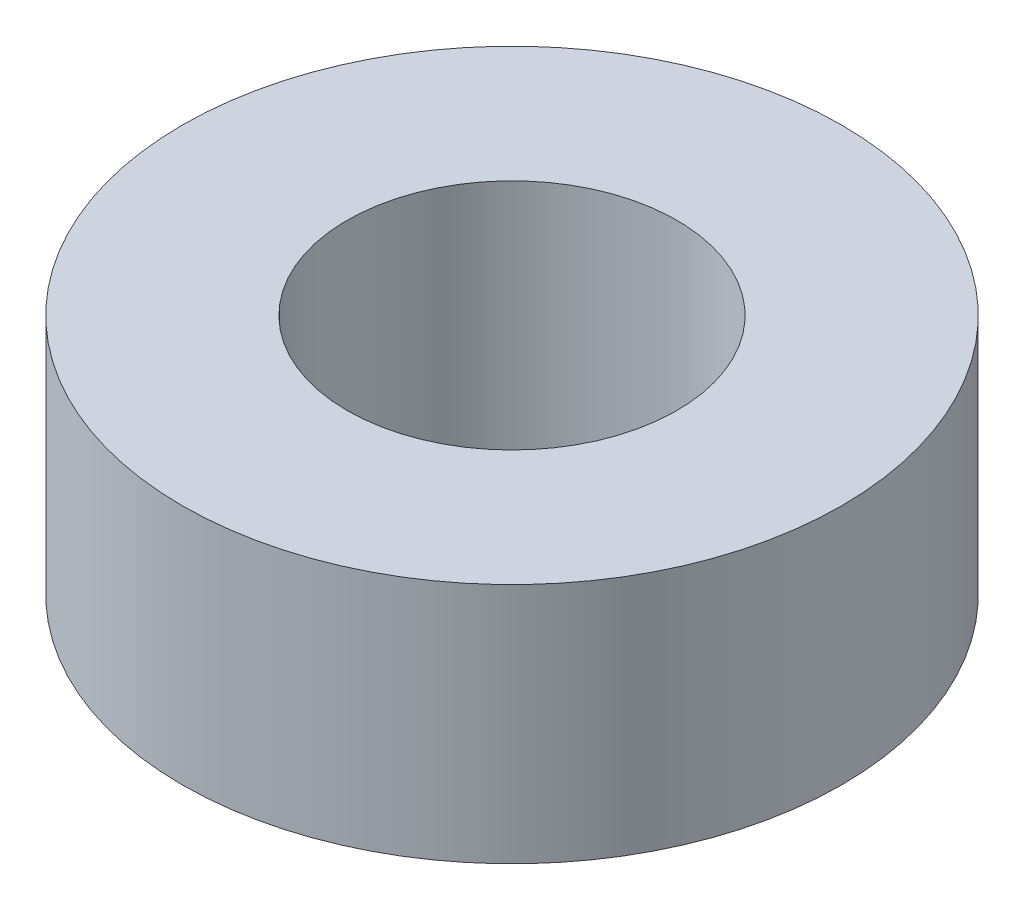
from build123d import *

# Parameters (mm, degrees)
SKETCH1_R           = 150
SKETCH1_R_2         = 75
BOSS_EXTRUDE1_DEPTH = 55


with BuildPart() as part:
    # Sketch1 → Boss-Extrude1 (new, symmetric)
    with BuildSketch(Plane(origin=(0, 0, 0), x_dir=(1, 0, 0), z_dir=(0, 1, 0))):
        with Locations(Location((0, 0, 0), (0, 0, 270))):
            Circle(SKETCH1_R)
        with Locations(Location((0, 0, 0), (0, 0, 270))):
            Circle(SKETCH1_R_2, mode=Mode.SUBTRACT)
    extrude(amount=BOSS_EXTRUDE1_DEPTH, both=True)


solid = part.part
